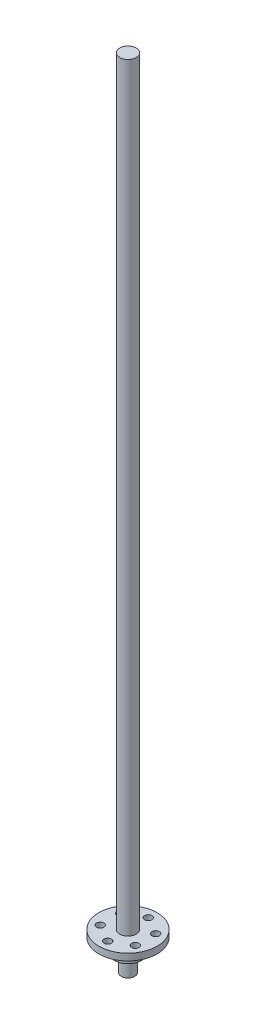
from build123d import *

# Parameters (mm, degrees)
SKETCH1_R           = 26.845
BOSS_EXTRUDE1_DEPTH = 6.23
SKETCH2_R           = 7.625
BOSS_EXTRUDE2_DEPTH = 700
SKETCH3_R           = 12.91
BOSS_EXTRUDE3_DEPTH = 12
SKETCH4_R           = 3.394618091
CUT_EXTRUDE1_DEPTH  = 12
CIRPATTERN1_COUNT   = 6
SKETCH6_R           = 6.26
BOSS_EXTRUDE4_DEPTH = 16.13


with BuildPart() as part:
    # Sketch1 → Boss-Extrude1 (new body)
    with BuildSketch(Plane(origin=(0, 0, 0), x_dir=(1, 0, 0), z_dir=(0, 1, 0))):
        Circle(SKETCH1_R)
    extrude(amount=BOSS_EXTRUDE1_DEPTH)

    # Sketch2 → Boss-Extrude2 (add)
    with BuildSketch(Plane(origin=(0, 6.23, 0), x_dir=(1, 0, 0), z_dir=(0, 1, 0))):
        Circle(SKETCH2_R)
    extrude(amount=BOSS_EXTRUDE2_DEPTH)

    # Sketch3 → Boss-Extrude3 (add)
    with BuildSketch(Plane.XZ):
        Circle(SKETCH3_R)
    extrude(amount=BOSS_EXTRUDE3_DEPTH)

    # Sketch4 → Cut-Extrude1 (cut)
    with BuildSketch(Plane(origin=(0, 0, 0), x_dir=(-1, 0, 0), z_dir=(0, -1, 0))):
        with Locations((0, 18.718198498)):
            Circle(SKETCH4_R)
    cut_extrude1 = extrude(amount=-CUT_EXTRUDE1_DEPTH, mode=Mode.SUBTRACT)

    # CirPattern1: Cut-Extrude1 ×6 about axis
    cirpattern1_axis = Axis((0, -12, 0), (0, 1, 0))
    for i in range(1, CIRPATTERN1_COUNT):
        add(cut_extrude1.rotate(cirpattern1_axis, i * 360 / CIRPATTERN1_COUNT), mode=Mode.SUBTRACT)

    # Sketch6 → Boss-Extrude4 (add)
    with BuildSketch(Plane(origin=(0, -12, 0), x_dir=(-1, 0, 0), z_dir=(0, -1, 0))):
        Circle(SKETCH6_R)
    extrude(amount=BOSS_EXTRUDE4_DEPTH)


solid = part.part
